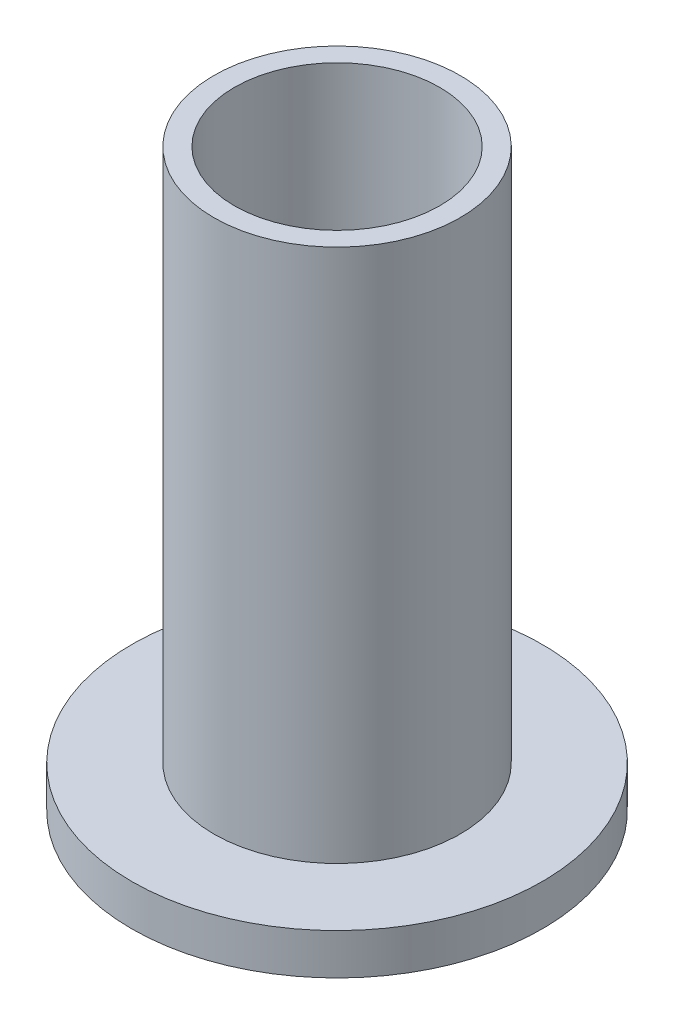
from build123d import *


with BuildPart() as part:
    # Sketch1 → Revolve1 (revolve)
    with BuildSketch(Plane.XY, mode=Mode.PRIVATE) as revolve1_sk:
        Polygon((-5, 17.14556962), (-5, -10.85443038), (-10, -10.85443038), (-10, -8.85443038), (-6, -8.85443038), (-6, 17.14556962), align=None)
    revolve(revolve1_sk.sketch.rotate(Axis((0, 15.284810127, 0), (0, -1, 0)), 270), axis=Axis((0, 15.284810127, 0), (0, -1, 0)))


solid = part.part
